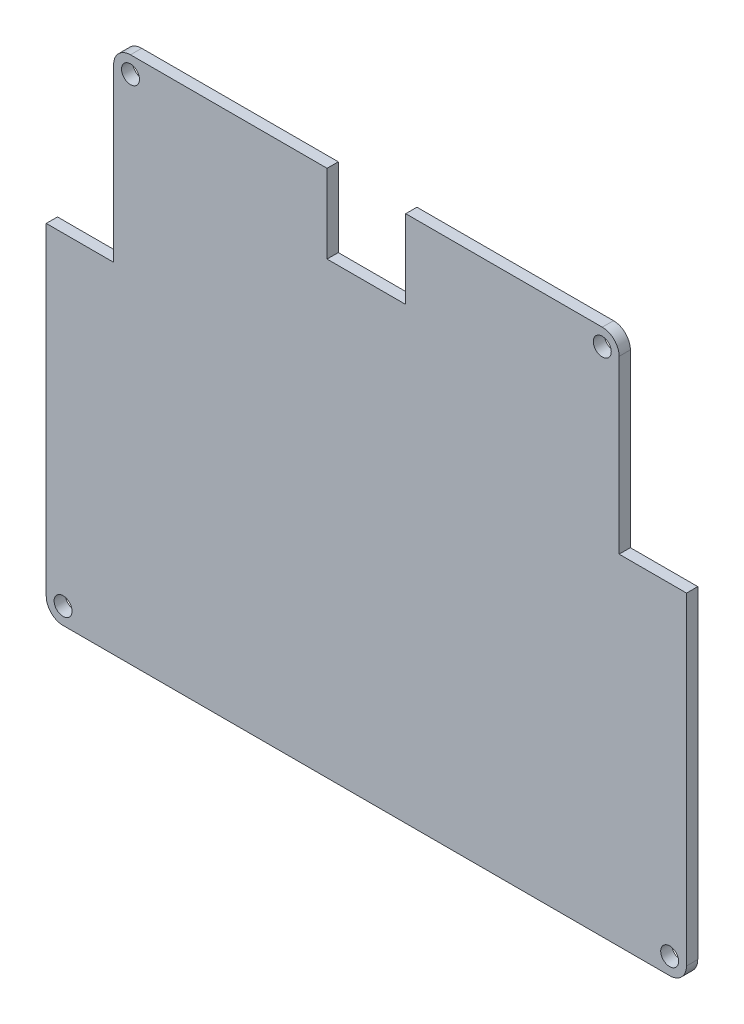
from build123d import *

# Parameters (mm, degrees)
SKETCH1_R           = 1.6
BOSS_EXTRUDE1_DEPTH = 2


with BuildPart() as part:
    # Sketch1 → Boss-Extrude1 (new body)
    with BuildSketch(Plane.XY):
        with BuildLine():
            Line((-45, 28.314832437), (-57, 28.314832437))
            Line((-57, 28.314832437), (-57, -29.185167563))
            ThreePointArc((-57, -29.185167563), (-56.121320344, -31.306487906), (-54, -32.185167563))
            Line((-54, -32.185167563), (54, -32.185167563))
            ThreePointArc((54, -32.185167563), (56.121320344, -31.306487906), (57, -29.185167563))
            Line((57, -29.185167563), (57, 28.314832437))
            Line((57, 28.314832437), (45, 28.314832437))
            Line((45, 28.314832437), (45, 58.814832437))
            ThreePointArc((45, 58.814832437), (44.121320344, 60.936152781), (42, 61.814832437))
            Line((42, 61.814832437), (7, 61.814832437))
            Line((7, 61.814832437), (7, 47.814832437))
            Line((7, 47.814832437), (-7, 47.814832437))
            Line((-7, 47.814832437), (-7, 61.814832437))
            Line((-7, 61.814832437), (-42, 61.814832437))
            ThreePointArc((-42, 61.814832437), (-44.121320344, 60.936152781), (-45, 58.814832437))
            Line((-45, 58.814832437), (-45, 28.314832437))
        make_face()
        with Locations((54, -29.185167563)):
            Circle(SKETCH1_R, mode=Mode.SUBTRACT)
        with Locations(Location((-54, -29.185167563, 0), (0, 0, 180))):
            Circle(SKETCH1_R, mode=Mode.SUBTRACT)
        with Locations((42, 58.814832437)):
            Circle(SKETCH1_R, mode=Mode.SUBTRACT)
        with Locations(Location((-42, 58.814832437, 0), (0, 0, 180))):
            Circle(SKETCH1_R, mode=Mode.SUBTRACT)
    extrude(amount=BOSS_EXTRUDE1_DEPTH)


solid = part.part
